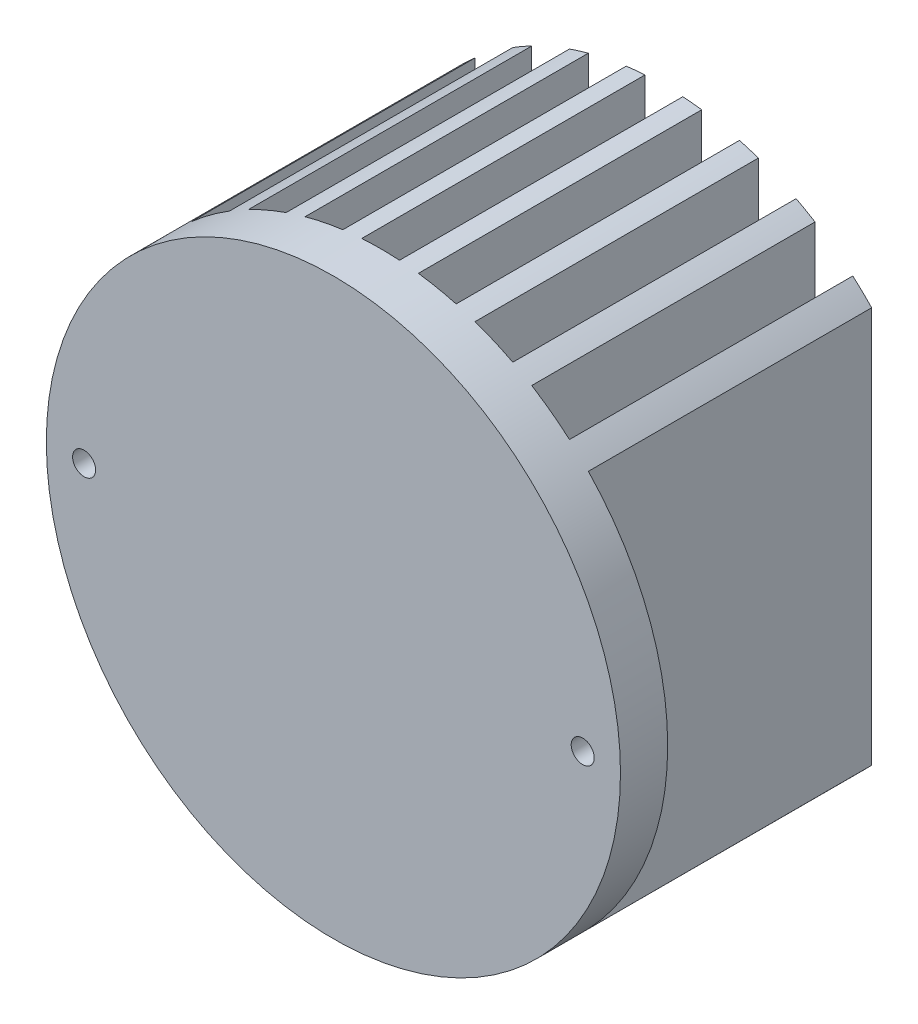
from build123d import *

# Parameters (mm, degrees)
SKETCH1_R               = 30.4
BOSS_EXTRUDE1_DEPTH     = 35
SKETCH4_W               = 4
SKETCH4_H               = 60.8
CUT_EXTRUDE1_DEPTH      = 30
LPATTERN1_COUNT         = 5
LPATTERN1_PITCH         = 6
MIRROR1_COPY_1_SKETCH_W = 4
MIRROR1_COPY_1_SKETCH_H = 60.8
MIRROR1_COPY_1_DEPTH    = 30
MIRROR1_COPY_2_SKETCH_W = 4
MIRROR1_COPY_2_SKETCH_H = 60.8
MIRROR1_COPY_2_DEPTH    = 30
MIRROR1_COPY_3_SKETCH_W = 4
MIRROR1_COPY_3_SKETCH_H = 60.8
MIRROR1_COPY_3_DEPTH    = 30
MIRROR1_COPY_4_SKETCH_W = 4
MIRROR1_COPY_4_SKETCH_H = 60.8
MIRROR1_COPY_4_DEPTH    = 30
MIRROR1_COPY_5_SKETCH_W = 4
MIRROR1_COPY_5_SKETCH_H = 60.8
MIRROR1_COPY_5_DEPTH    = 30
SKETCH9_W               = 4.4
SKETCH9_H               = 31.506189868
CUT_EXTRUDE2_DEPTH      = 30


with BuildPart() as part:
    # Sketch1 → Boss-Extrude1 (new body)
    with BuildSketch(Plane.XY):
        Circle(SKETCH1_R)
    extrude(amount=BOSS_EXTRUDE1_DEPTH)

    # Sketch4 → Cut-Extrude1 (cut)
    with BuildSketch(Plane(origin=(0, 0, 0), x_dir=(-1, 0, 0), z_dir=(0, 0, -1))):
        Rectangle(SKETCH4_W, SKETCH4_H)
    cut_extrude1 = extrude(amount=-CUT_EXTRUDE1_DEPTH, mode=Mode.SUBTRACT)

    # LPattern1: Cut-Extrude1 ×5
    with Locations(*[(i * LPATTERN1_PITCH, 0, 0) for i in range(1, LPATTERN1_COUNT)]):
        add(cut_extrude1, mode=Mode.SUBTRACT)

    # Mirror1 copy 1 sketch → Mirror1 copy 1 (cut)
    with BuildSketch(Plane(origin=(-6, 0, 0), x_dir=(1, 0, 0), z_dir=(0, 0, -1))):
        Rectangle(MIRROR1_COPY_1_SKETCH_W, MIRROR1_COPY_1_SKETCH_H)
    extrude(amount=-MIRROR1_COPY_1_DEPTH, mode=Mode.SUBTRACT)

    # Mirror1 copy 2 sketch → Mirror1 copy 2 (cut)
    with BuildSketch(Plane(origin=(-12, 0, 0), x_dir=(1, 0, 0), z_dir=(0, 0, -1))):
        Rectangle(MIRROR1_COPY_2_SKETCH_W, MIRROR1_COPY_2_SKETCH_H)
    extrude(amount=-MIRROR1_COPY_2_DEPTH, mode=Mode.SUBTRACT)

    # Mirror1 copy 3 sketch → Mirror1 copy 3 (cut)
    with BuildSketch(Plane(origin=(-18, 0, 0), x_dir=(1, 0, 0), z_dir=(0, 0, -1))):
        Rectangle(MIRROR1_COPY_3_SKETCH_W, MIRROR1_COPY_3_SKETCH_H)
    extrude(amount=-MIRROR1_COPY_3_DEPTH, mode=Mode.SUBTRACT)

    # Mirror1 copy 4 sketch → Mirror1 copy 4 (cut)
    with BuildSketch(Plane(origin=(-24, 0, 0), x_dir=(1, 0, 0), z_dir=(0, 0, -1))):
        Rectangle(MIRROR1_COPY_4_SKETCH_W, MIRROR1_COPY_4_SKETCH_H)
    extrude(amount=-MIRROR1_COPY_4_DEPTH, mode=Mode.SUBTRACT)

    # Mirror1 copy 5 sketch → Mirror1 copy 5 (cut)
    with BuildSketch(Plane(origin=(0, 0, 0), x_dir=(1, 0, 0), z_dir=(0, 0, -1))):
        Rectangle(MIRROR1_COPY_5_SKETCH_W, MIRROR1_COPY_5_SKETCH_H)
    extrude(amount=-MIRROR1_COPY_5_DEPTH, mode=Mode.SUBTRACT)

    # Sketch9 → Cut-Extrude2 (cut)
    with BuildSketch(Plane(origin=(0, 0, 0), x_dir=(-1, 0, 0), z_dir=(0, 0, -1))):
        with Locations((-28.2, 0)):
            Rectangle(SKETCH9_W, SKETCH9_H)
        with Locations((28.2, 0)):
            Rectangle(SKETCH9_W, SKETCH9_H)
    extrude(amount=-CUT_EXTRUDE2_DEPTH, mode=Mode.SUBTRACT)

    # Sketch14 → CBORE for #2 Binding Head Machine Screw2 (revolve, cut)
    with BuildSketch(Plane(origin=(26.4, 0, 30), x_dir=(0, 1, 0), z_dir=(1, 0, 0))):
        Polygon((0, 0), (0, 5.732569267), (1.2192, 5), (1.2192, 1.27), (2.77876, 1.27), (2.77876, 0), align=None)
    cbore_for_2_binding_head_machine_screw2 = revolve(axis=Axis((26.4, 0, 23.65), (0, 0, 1)), mode=Mode.SUBTRACT)

    # Mirror2: CBORE for #2 Binding Head Machine Screw2 across plane
    add(cbore_for_2_binding_head_machine_screw2.mirror(Plane(origin=(0, 0, 0), x_dir=(0, 0, 1), z_dir=(1, 0, 0))), mode=Mode.SUBTRACT)


solid = part.part
